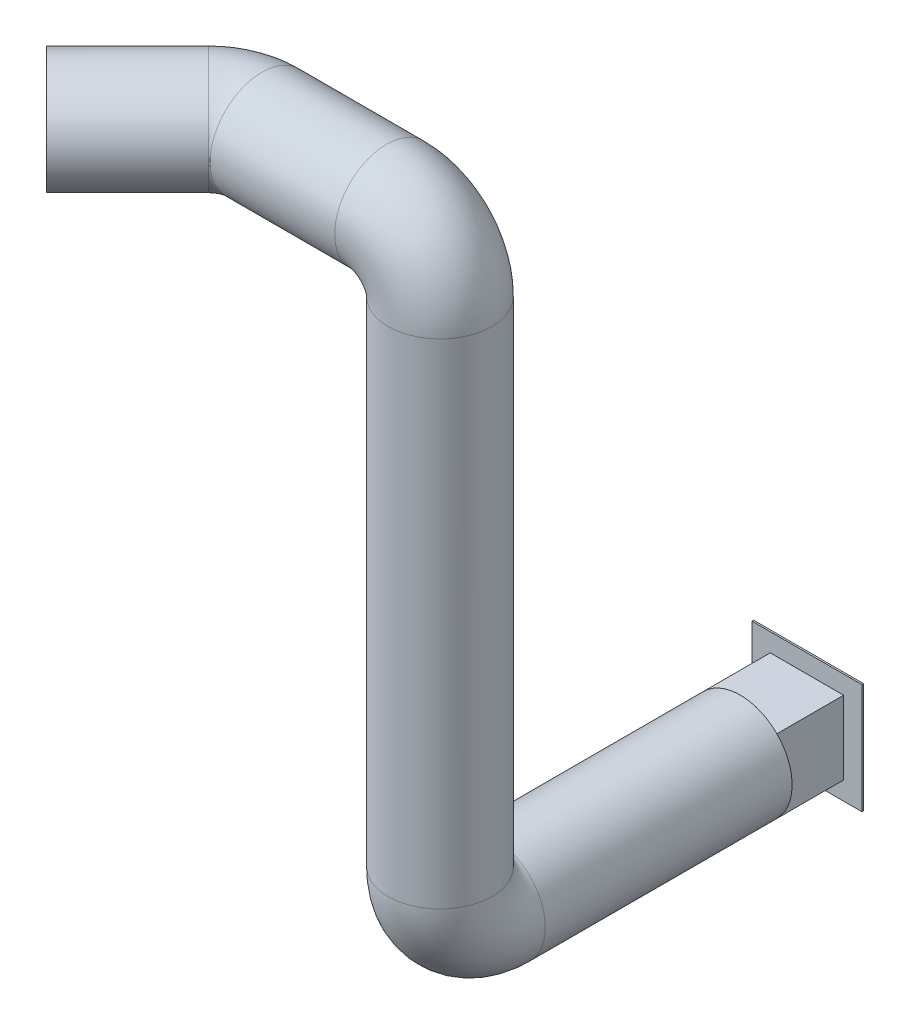
from build123d import *
from build123d.topology import SkipClean

# Parameters (mm, degrees)
CROQUIS1_W              = 165
CROQUIS1_H              = 165
CROQUIS1_W_2            = 105
CROQUIS1_H_2            = 105
SALIENTE_EXTRUIR1_DEPTH = 2.5
CROQUIS2_W              = 110
CROQUIS2_H              = 110
CROQUIS2_W_2            = 105
CROQUIS2_H_2            = 105
SALIENTE_EXTRUIR2_DEPTH = 100
CROQUIS3_R              = 77.781745931
SALIENTE_EXTRUIR3_DEPTH = 100
CROQUIS5_R              = 77.781745931


with BuildPart() as part:
    # Croquis1 → Saliente-Extruir1 (new body)
    with BuildSketch(Plane.XY):
        with Locations((82.5, -82.5)):
            Rectangle(CROQUIS1_W, CROQUIS1_H)
        with Locations((82.5, -82.5)):
            Rectangle(CROQUIS1_W_2, CROQUIS1_H_2, mode=Mode.SUBTRACT)
    extrude(amount=SALIENTE_EXTRUIR1_DEPTH)

    # Croquis2 → Saliente-Extruir2 (add)
    with BuildSketch(Plane.XY.offset(2.5)):
        with Locations((82.5, -82.5)):
            Rectangle(CROQUIS2_W, CROQUIS2_H)
        with Locations((82.5, -82.5)):
            Rectangle(CROQUIS2_W_2, CROQUIS2_H_2, mode=Mode.SUBTRACT)
    extrude(amount=SALIENTE_EXTRUIR2_DEPTH)

    # Croquis3 → Saliente-Extruir3 (add)
    with BuildSketch(Plane.XY.offset(102.5)):
        with Locations(Location((82.5, -82.5, 0), (0, 0, 135))):
            Circle(CROQUIS3_R)
    extrude(amount=SALIENTE_EXTRUIR3_DEPTH)

    # Barrer1: sweep along a curve in space
    with SkipClean():  # the faces are left unmerged after this step: merging them gives an invalid solid
        with BuildLine() as barrer1_path:
            Line((82.5, -82.5, 202.5), (82.5, -82.5, 472.5))
            ThreePointArc((82.5, -82.5, 472.5), (82.5, -59.068542495, 529.068542495), (82.5, -2.5, 552.5))
            Line((82.5, -2.5, 552.5), (82.5, 737.5, 552.5))
            ThreePointArc((82.5, 737.5, 552.5), (59.068542495, 794.068542495, 552.5), (2.5, 817.5, 552.5))
            Line((2.5, 817.5, 552.5), (-184.36291501, 817.5, 552.5))
            ThreePointArc((-184.36291501, 817.5, 552.5), (-214.977589599, 817.5, 558.589637399), (-240.931457505, 817.5, 575.931457505))
            Line((-362.5, 817.5, 697.5), (-240.931457505, 817.5, 575.931457505))
        # Croquis5 → Barrer1 (sweep)
        with BuildSketch(Plane.XY.offset(202.5)):
            with Locations((82.5, -82.5)):
                Circle(CROQUIS5_R)
        sweep(path=barrer1_path.line)


solid = part.part
